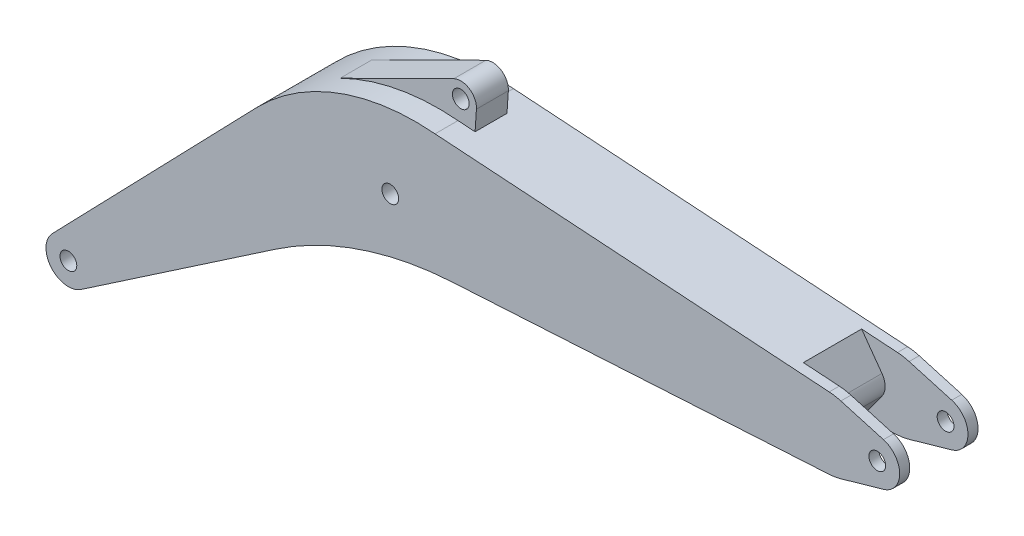
from build123d import *

# Parameters (mm, degrees)
EXTRUDE_1_DEPTH          = 7
EXTRUDE_1_DEPTH_BACK     = 7
SKETCH_1_R               = 1.5
FILLET_1_R               = 10
EXTRUDE_2_DEPTH          = 2.9
EXTRUDE_2_DEPTH_BACK     = 2.8
SKETCH_3_R               = 1.5
CUT_EXTRUDE_1_DEPTH      = 5.2
CUT_EXTRUDE_1_DEPTH_BACK = 5.2


with BuildPart() as part:
    # 草图1 → 凸台-拉伸1 (new, two sides: drawn at the far end of the back side and taken through both)
    with BuildSketch(Plane.XY.offset(-EXTRUDE_1_DEPTH_BACK)):
        with BuildLine():
            ThreePointArc((132.1, 80.8), (147.125308547, 88.283437456), (163.6, 91.5))
            Line((163.6, 91.5), (232.071936087, 95.488208898))
            Line((232.071936087, 95.488208898), (240.699236038, 97.954004663))
            ThreePointArc((240.699236038, 97.954004663), (243.6, 101.8), (240.699236038, 105.645995337))
            Line((240.699236038, 105.645995337), (232.071936087, 108.111791102))
            Line((232.071936087, 108.111791102), (160.6, 112.9))
            ThreePointArc((160.6, 112.9), (143.303490983, 110.55954938), (128.7, 101))
            Line((128.7, 101), (92.224555949, 63.280615311))
            ThreePointArc((92.224555949, 63.280615311), (92.03920173, 57.924827394), (97.347754748, 57.19128445))
            Line((97.347754748, 57.19128445), (132.1, 80.8))
        make_face()
        with Locations((95.1, 60.5)):
            Circle(SKETCH_1_R, mode=Mode.SUBTRACT)
        with Locations((152.6, 99.603139307)):
            Circle(SKETCH_1_R, mode=Mode.SUBTRACT)
        with Locations((239.6, 101.8)):
            Circle(SKETCH_1_R, mode=Mode.SUBTRACT)
    extrude(amount=EXTRUDE_1_DEPTH + EXTRUDE_1_DEPTH_BACK)

    # 圆角1
    fillet_1_edges = [part.edges().sort_by_distance(p)[0] for p in [
        (232.071936087, 95.488208898, 0),
        (232.071936087, 108.111791102, 0),
    ]]
    fillet(fillet_1_edges, radius=FILLET_1_R)

    # 草图3 → 凸台-拉伸2 (add, two sides: drawn at the far end of the back side and taken through both)
    with BuildSketch(Plane.XY.offset(-EXTRUDE_2_DEPTH_BACK)):
        with BuildLine():
            Line((160.6, 112.9), (163.651401787, 112.69557362))
            Line((163.651401787, 112.69557362), (163.893737551, 116.312835642))
            ThreePointArc((163.893737551, 116.312835642), (162.654460758, 118.828873494), (159.855517856, 119.008239262))
            Line((159.855517856, 119.008239262), (139.549521827, 108.933263618))
            ThreePointArc((139.549521827, 108.933263618), (149.801009446, 112.369362402), (160.6, 112.9))
        make_face()
        with Locations((161.1, 116.5)):
            Circle(SKETCH_3_R, mode=Mode.SUBTRACT)
    extrude(amount=EXTRUDE_2_DEPTH + EXTRUDE_2_DEPTH_BACK)

    # 草图4 → 切除-拉伸1 (cut, two sides: drawn at the far end of the back side and taken through both)
    with BuildSketch(Plane.XY.offset(-CUT_EXTRUDE_1_DEPTH_BACK)):
        with BuildLine():
            Line((231.012866709, 108.182742662), (224.6, 108.612367871))
            Line((224.6, 108.612367871), (228.236474469, 103.550312019))
            ThreePointArc((228.236474469, 103.550312019), (228.799985675, 101.790729145), (228.225610058, 100.034662683))
            Line((228.225610058, 100.034662683), (224.6, 95.052999327))
            Line((224.6, 95.052999327), (230.968280992, 95.423925524))
            ThreePointArc((230.968280992, 95.423925524), (232.061731819, 95.548272011), (233.134897693, 95.792017302))
            Line((233.134897693, 95.792017302), (240.699236038, 97.954004663))
            ThreePointArc((240.699236038, 97.954004663), (243.6, 101.8), (240.699236038, 105.645995337))
            Line((240.699236038, 105.645995337), (233.092512669, 107.820096895))
            ThreePointArc((233.092512669, 107.820096895), (232.062285935, 108.056450871), (231.012866709, 108.182742662))
        make_face()
    extrude(amount=CUT_EXTRUDE_1_DEPTH + CUT_EXTRUDE_1_DEPTH_BACK, mode=Mode.SUBTRACT)


solid = part.part
